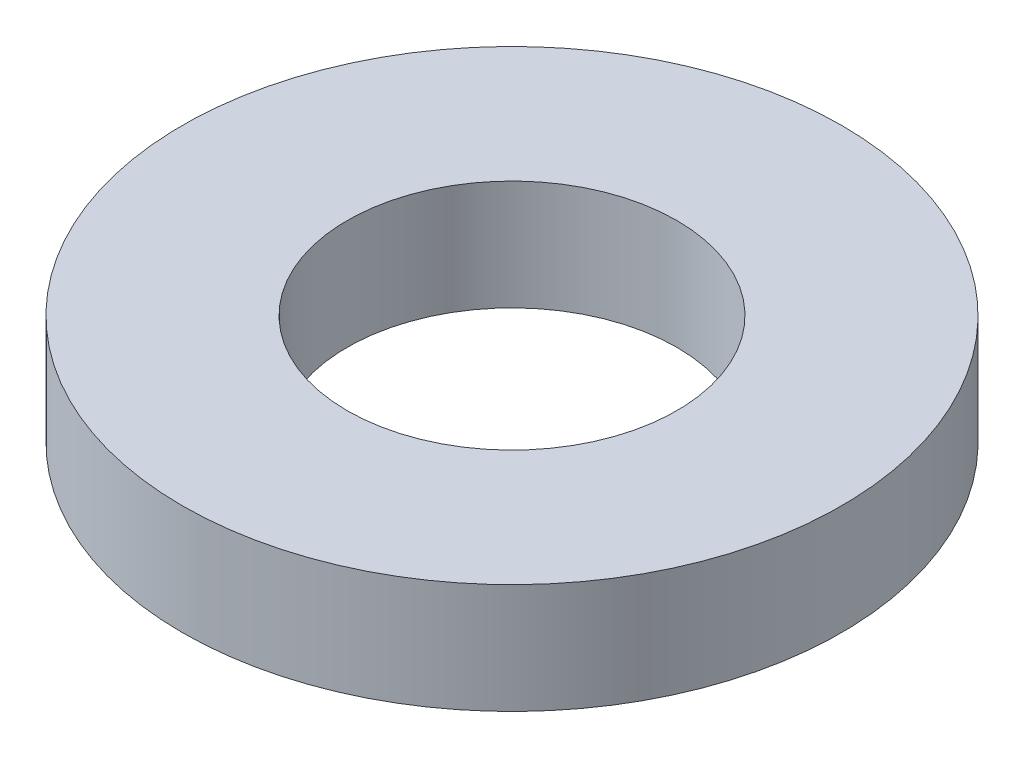
from build123d import *

# Parameters (mm, degrees)
SKETCH1_R           = 30
SKETCH1_R_2         = 15
BOSS_EXTRUDE1_DEPTH = 10


with BuildPart() as part:
    # Sketch1 → Boss-Extrude1 (new body)
    with BuildSketch(Plane(origin=(0, 0, 0), x_dir=(1, 0, 0), z_dir=(0, 1, 0))):
        with Locations(Location((0, 0, 0), (0, 0, 270))):
            Circle(SKETCH1_R)
        with Locations(Location((0, 0, 0), (0, 0, 270))):
            Circle(SKETCH1_R_2, mode=Mode.SUBTRACT)
    extrude(amount=BOSS_EXTRUDE1_DEPTH)


solid = part.part
